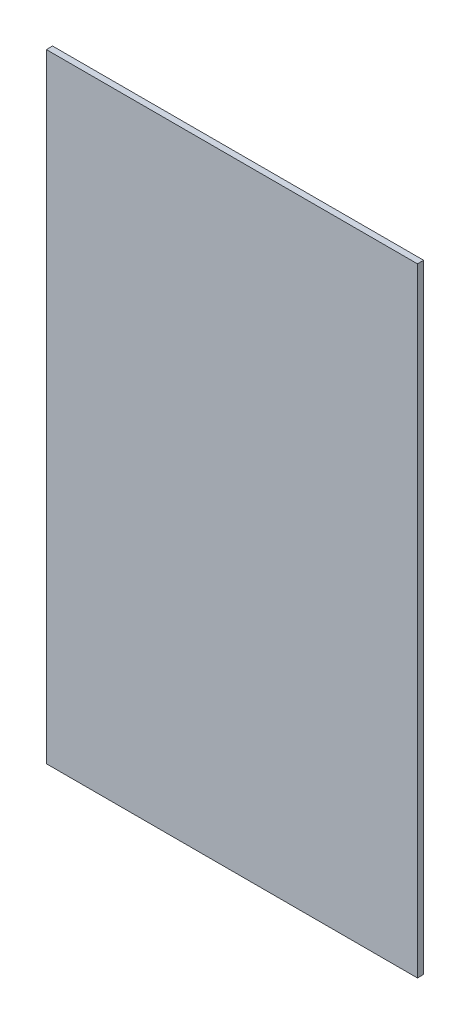
from build123d import *

# Parameters (mm, degrees)
SKETCH1_W           = 152.4
SKETCH1_H           = 254
BOSS_EXTRUDE1_DEPTH = 2.54


with BuildPart() as part:
    # Sketch1 → Boss-Extrude1 (new body)
    with BuildSketch(Plane.XY):
        with Locations((76.2, -127)):
            Rectangle(SKETCH1_W, SKETCH1_H)
    extrude(amount=BOSS_EXTRUDE1_DEPTH)


solid = part.part
